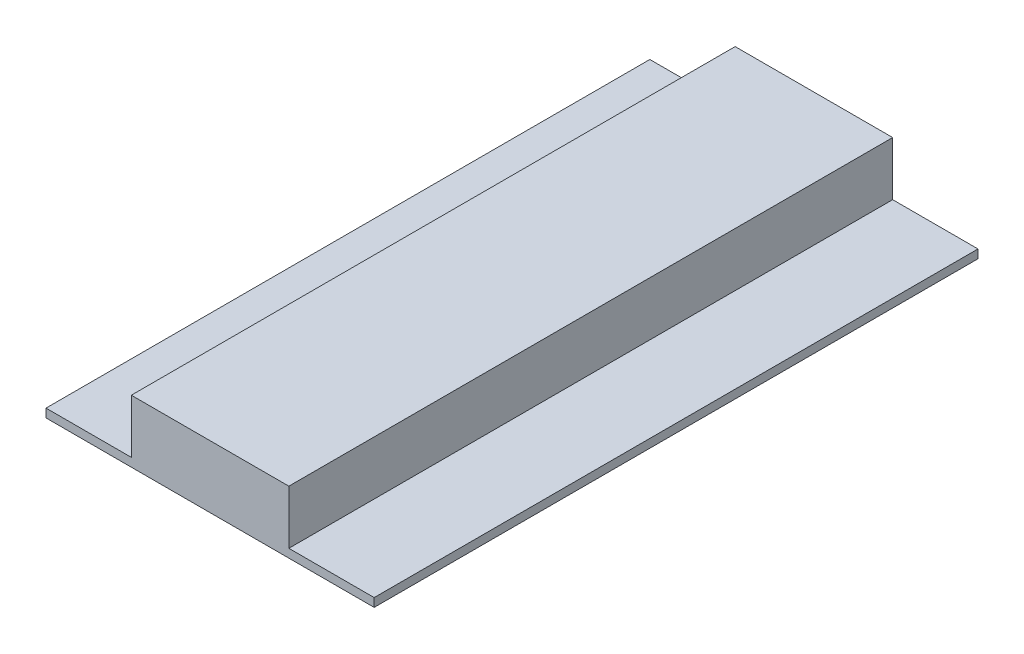
from build123d import *

# Parameters (mm, degrees)
BOSS_EXTRUDE1_DEPTH = 46


with BuildPart() as part:
    # Sketch1 → Boss-Extrude1 (new, symmetric)
    with BuildSketch(Plane.XY):
        Polygon((-25, 1.3), (-25, 0), (25, 0), (25, 1.3), (12, 1.3), (12, 9.5), (-12, 9.5), (-12, 1.3), align=None)
    extrude(amount=BOSS_EXTRUDE1_DEPTH, both=True)


solid = part.part
